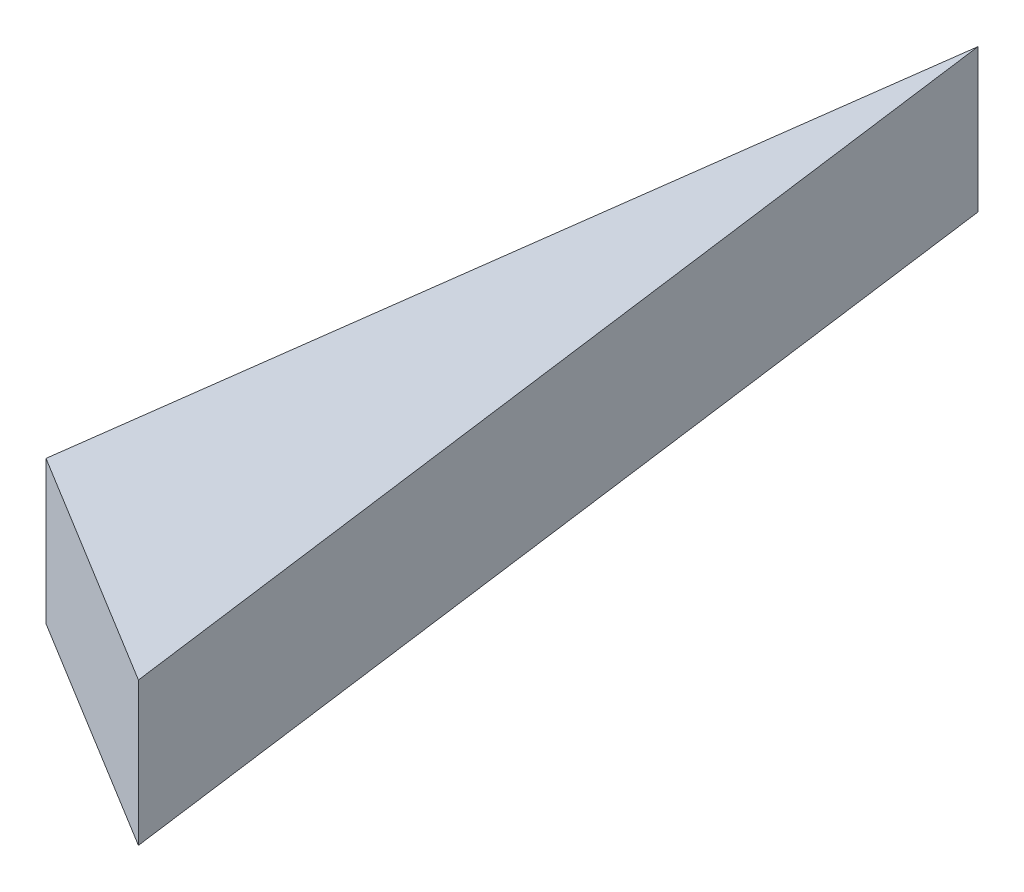
from build123d import *

# Parameters (mm, degrees)
MAIN_EXTRUDE_DEPTH = 65.09
SHELL1_T           = -5


with BuildPart() as part:
    # Sketch1 → Main extrude (new, symmetric)
    with BuildSketch(Plane(origin=(0, 0, 0), x_dir=(1, 0, 0), z_dir=(0, 1, 0))):
        Polygon((0, 0), (-99.438353003, -747.757212972), (117.055, -880.2309966), align=None)
    extrude(amount=MAIN_EXTRUDE_DEPTH, both=True)

    # Shell1
    shell1_openings = [part.faces().sort_by_distance(p)[0] for p in [
        (5.872215666, -65.09, 542.662736524),
    ]]
    offset(amount=SHELL1_T, openings=shell1_openings, kind=Kind.INTERSECTION)


solid = part.part
